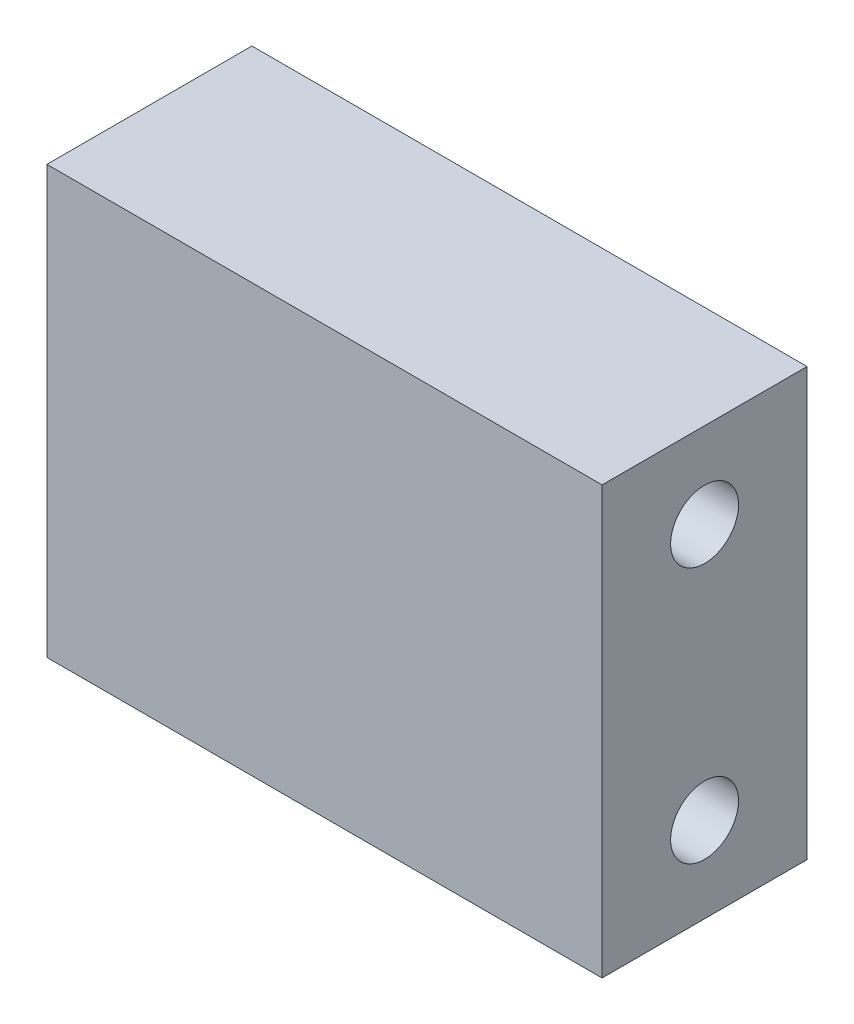
from build123d import *

# Parameters (mm, degrees)
SKETCH1_W                           = 12.192
SKETCH1_H                           = 25.4
BOSS_EXTRUDE1_DEPTH                 = 16.51
TAP_DRILL_FOR_10_32_TAP1_AT_2_COUNT = 2
TAP_DRILL_FOR_10_32_TAP1_AT_2_PITCH = 15.24


with BuildPart() as part:
    # Sketch1 → Boss-Extrude1 (new, symmetric)
    with BuildSketch(Plane(origin=(0, 0, 0), x_dir=(0, 0, -1), z_dir=(1, 0, 0))):
        Rectangle(SKETCH1_W, SKETCH1_H)
    extrude(amount=BOSS_EXTRUDE1_DEPTH, both=True)

    # Sketch4 → Tap Drill for #10-32 Tap1 (revolve, cut)
    with BuildSketch(Plane(origin=(16.51, 7.62, 0), x_dir=(0, 0, -1), z_dir=(0, 1, 0))):
        Polygon((0, 0), (0, 11.373317848), (2.0193, 10.16), (2.0193, 0), align=None)
    tap_drill_for_10_32_tap1 = revolve(axis=Axis((22.86, 7.62, 0), (-1, 0, 0)), mode=Mode.SUBTRACT)

    # Tap Drill for #10-32 Tap1 at 2: Tap Drill for #10-32 Tap1 ×2
    with Locations(*[(0, -i * TAP_DRILL_FOR_10_32_TAP1_AT_2_PITCH, 0) for i in range(1, TAP_DRILL_FOR_10_32_TAP1_AT_2_COUNT)]):
        add(tap_drill_for_10_32_tap1, mode=Mode.SUBTRACT)

    # Mirror1: Tap Drill for #10-32 Tap1 across plane
    add(tap_drill_for_10_32_tap1.mirror(Plane(origin=(0, 0, 0), x_dir=(0, 0, 1), z_dir=(1, 0, 0))), mode=Mode.SUBTRACT)

    # Mirror1 copy 1 sketch → Mirror1 copy 1 (revolve, cut)
    with BuildSketch(Plane(origin=(-16.51, -7.62, 0), x_dir=(0, 0, -1), z_dir=(0, 1, 0))):
        Polygon((0, 0), (0, -11.373317848), (2.0193, -10.16), (2.0193, 0), align=None)
    revolve(axis=Axis((-22.86, -7.62, 0), (-1, 0, 0)), mode=Mode.SUBTRACT)


solid = part.part
